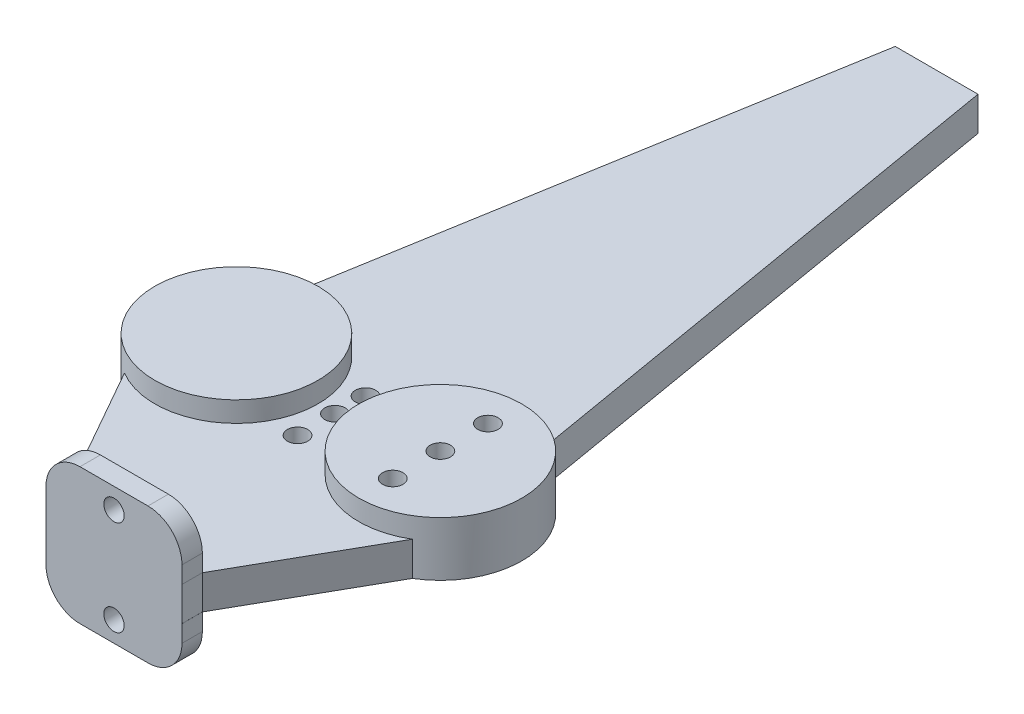
from build123d import *

# Parameters (mm, degrees)
SKETCH1_R                      = 12
SKETCH1_W                      = 20
SKETCH1_H                      = 15
BOSS_EXTRUDE1_DEPTH            = 5
SKETCH2_R                      = 12
BOSS_EXTRUDE2_DEPTH            = 3
SKETCH3_W                      = 19.985503564
SKETCH3_H                      = 5
BOSS_EXTRUDE12_DEPTH           = 3
FILLET1_R                      = 5
F_3_0MM_DOWEL_HOLE1_AT_2_COUNT = 2
F_3_0MM_DOWEL_HOLE1_AT_2_PITCH = 14
F_3_0MM_DOWEL_HOLE2_AT_2_COUNT = 2
F_3_0MM_DOWEL_HOLE2_AT_2_PITCH = 7
F_3_0MM_DOWEL_HOLE2_AT_3_COUNT = 2
F_3_0MM_DOWEL_HOLE2_AT_3_PITCH = 7
F_3_0MM_DOWEL_HOLE2_AT_4_COUNT = 2
F_3_0MM_DOWEL_HOLE2_AT_4_PITCH = 15.501479882
F_3_0MM_DOWEL_HOLE2_AT_5_COUNT = 2
F_3_0MM_DOWEL_HOLE2_AT_5_PITCH = 16.45
F_3_0MM_DOWEL_HOLE2_AT_6_COUNT = 2
F_3_0MM_DOWEL_HOLE2_AT_6_PITCH = 16.14


with BuildPart() as part:
    # Sketch1 → Boss-Extrude1 (new body)
    with BuildSketch(Plane(origin=(0, 0, 0), x_dir=(1, 0, 0), z_dir=(0, 1, 0))):
        with BuildLine():
            Line((-6.086540156, 59), (-19.168461188, -17.74727005))
            ThreePointArc((-19.168461188, -17.74727005), (-12.983628308, -17.170619408), (-7.339080595, -19.763641742))
            Line((-7.339080595, -19.763641742), (0, 23.29229775))
            Line((0, 23.29229775), (7.339080595, -19.763641742))
            ThreePointArc((7.339080595, -19.763641742), (12.983628308, -17.170619408), (19.168461188, -17.74727005))
            Line((19.168461188, -17.74727005), (6.086540156, 59))
            Line((6.086540156, 59), (-6.086540156, 59))
        make_face()
        with BuildLine():
            Line((-10, -59), (-10, -44))
            Line((-10, -44), (10, -44))
            Line((10, -44), (10, -59))
            Line((10, -59), (21.166526493, -39.294365013))
            ThreePointArc((21.166526493, -39.294365013), (5.206094221, -35.933931755), (7.339080595, -19.763641742))
            Line((7.339080595, -19.763641742), (0, 23.29229775))
            Line((0, 23.29229775), (-7.339080595, -19.763641742))
            ThreePointArc((-7.339080595, -19.763641742), (-4.13880686, -23.897600215), (-3, -29))
            ThreePointArc((-3, -29), (-9.083849136, -39.44026623), (-21.166526493, -39.294365013))
            Line((-21.166526493, -39.294365013), (-10, -59))
        make_face()
        with Locations((15, -29)):
            Circle(SKETCH1_R)
        with Locations((-15, -29)):
            Circle(SKETCH1_R)
        with Locations((0, -51.5)):
            Rectangle(SKETCH1_W, SKETCH1_H)
    extrude(amount=BOSS_EXTRUDE1_DEPTH)

    # Sketch2 → Boss-Extrude2 (add)
    with BuildSketch(Plane(origin=(0, 5, 0), x_dir=(1, 0, 0), z_dir=(0, 1, 0))):
        with Locations(Location((15, -29, 0), (0, 0, 69.673355432))):
            Circle(SKETCH2_R)
        with Locations(Location((-15, -29, 0), (0, 0, 110.326644568))):
            Circle(SKETCH2_R)
    extrude(amount=BOSS_EXTRUDE2_DEPTH)

    # Sketch9 → Ø3.0mm Dowel Hole2 (revolve, cut)
    with BuildSketch(Plane(origin=(15, 8, 29), x_dir=(0, 0, 1), z_dir=(1, 0, 0))):
        Polygon((0, 0), (0, 29.901290929), (1.5, 29), (1.5, 0), align=None)
    f_3_0mm_dowel_hole2 = revolve(axis=Axis((15, 14.35, 29), (0, -1, 0)), mode=Mode.SUBTRACT)

    # Ø3.0mm Dowel Hole2 at 2: Ø3.0mm Dowel Hole2 ×2
    with Locations(*[(0, 0, -i * F_3_0MM_DOWEL_HOLE2_AT_2_PITCH) for i in range(1, F_3_0MM_DOWEL_HOLE2_AT_2_COUNT)]):
        add(f_3_0mm_dowel_hole2, mode=Mode.SUBTRACT)

    # Ø3.0mm Dowel Hole2 at 3: Ø3.0mm Dowel Hole2 ×2
    with Locations(*[(0, 0, i * F_3_0MM_DOWEL_HOLE2_AT_3_PITCH) for i in range(1, F_3_0MM_DOWEL_HOLE2_AT_3_COUNT)]):
        add(f_3_0mm_dowel_hole2, mode=Mode.SUBTRACT)

    # Ø3.0mm Dowel Hole2 at 4: Ø3.0mm Dowel Hole2 ×2
    with Locations(*[(-i * F_3_0MM_DOWEL_HOLE2_AT_4_PITCH, 0, 0) for i in range(1, F_3_0MM_DOWEL_HOLE2_AT_4_COUNT)]):
        add(f_3_0mm_dowel_hole2, mode=Mode.SUBTRACT)

    # Ø3.0mm Dowel Hole2 at 5: Ø3.0mm Dowel Hole2 ×2
    with Locations(*[Vector(-0.9423392025471609, 0, 0.3346592705167166) * (i * F_3_0MM_DOWEL_HOLE2_AT_5_PITCH) for i in range(1, F_3_0MM_DOWEL_HOLE2_AT_5_COUNT)]):
        add(f_3_0mm_dowel_hole2, mode=Mode.SUBTRACT)

    # Ø3.0mm Dowel Hole2 at 6: Ø3.0mm Dowel Hole2 ×2
    with Locations(*[Vector(-0.9604386543928618, 0, -0.2784916356877332) * (i * F_3_0MM_DOWEL_HOLE2_AT_6_PITCH) for i in range(1, F_3_0MM_DOWEL_HOLE2_AT_6_COUNT)]):
        add(f_3_0mm_dowel_hole2, mode=Mode.SUBTRACT)


with BuildPart() as body_2:
    # Sketch3 → Boss-Extrude12 (new body)
    with BuildSketch(Plane.XY.offset(59)):
        Polygon((-10, 0), (-10, 5), (9.985503564, 5), (9.992751782, 5), (9.992751782, 12.5), (-10.007248218, 12.5), (-10.007248218, -7.5), (9.992751782, -7.5), (9.992751782, 0), (9.985503564, 0), align=None)
        with Locations((-0.007248218, 2.5)):
            Rectangle(SKETCH3_W, SKETCH3_H)
    extrude(amount=BOSS_EXTRUDE12_DEPTH)

    # Fillet1
    fillet1_edges = [body_2.edges().sort_by_distance(p)[0] for p in [
        (9.992751782, -7.5, 60.5),
        (-10.007248218, -7.5, 60.5),
        (-10.007248218, 12.5, 60.5),
        (9.992751782, 12.5, 60.5),
    ]]
    fillet(fillet1_edges, radius=FILLET1_R)

    # Sketch7 → Ø3.0mm Dowel Hole1 (revolve, cut)
    with BuildSketch(Plane(origin=(-0.007248218, 9.5, 59), x_dir=(0, 1, 0), z_dir=(1, 0, 0))):
        Polygon((0, 0), (0, 29.901290929), (1.5, 29), (1.5, 0), align=None)
    f_3_0mm_dowel_hole1 = revolve(axis=Axis((-0.007248218, 9.5, 52.65), (0, 0, 1)), mode=Mode.SUBTRACT)

    # Ø3.0mm Dowel Hole1 at 2: Ø3.0mm Dowel Hole1 ×2
    with Locations(*[(0, -i * F_3_0MM_DOWEL_HOLE1_AT_2_PITCH, 0) for i in range(1, F_3_0MM_DOWEL_HOLE1_AT_2_COUNT)]):
        add(f_3_0mm_dowel_hole1, mode=Mode.SUBTRACT)


solid = Compound([part.part, body_2.part])
